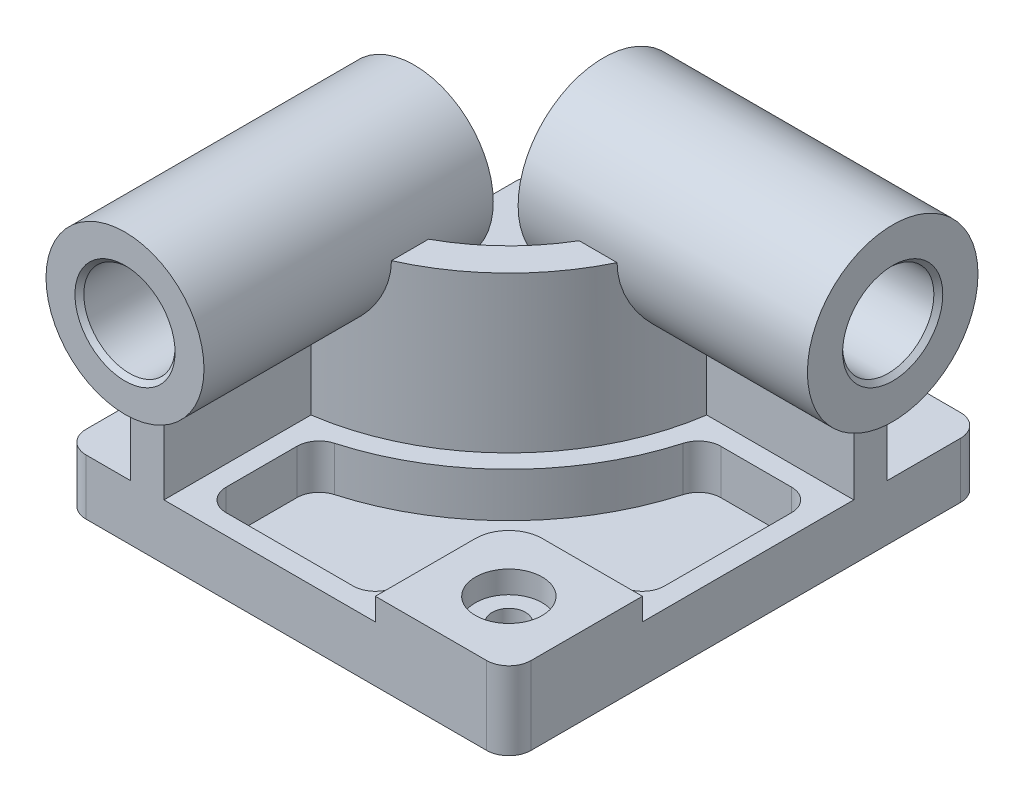
from build123d import *

# Parameters (mm, degrees)
BOSS_EXTRUDE1_DEPTH                     = 25
BOSS_EXTRUDE1_2_DEPTH                   = 25
BOSS_EXTRUDE2_DEPTH                     = 95
BOSS_EXTRUDE3_DEPTH                     = 35
BOSS_EXTRUDE4_DEPTH                     = 5
BOSS_EXTRUDE5_DEPTH                     = 10
BOSS_EXTRUDE5_DEPTH_BACK                = 120
SKETCH2_R                               = 35.5
SKETCH2_R_2                             = 20.5
BOSS_EXTRUDE6_DEPTH                     = 10
BOSS_EXTRUDE6_DEPTH_BACK                = 120
SKETCH3_R                               = 38.333333333
SKETCH3_R_2                             = 20.5
SKETCH4_R                               = 20.5
CUT_EXTRUDE1_DEPTH                      = 275.681684509
SKETCH5_R                               = 20.5
CUT_EXTRUDE2_DEPTH                      = 283.146731022
CHAMFER1_SIZE                           = 2
CBORE_FOR_M8_HEX_HEAD_BOLT1_D           = 15
CBORE_FOR_M8_HEX_HEAD_BOLT1_CBORE_D     = 30
CBORE_FOR_M8_HEX_HEAD_BOLT1_CBORE_DEPTH = 10


with BuildPart() as part:
    # Sketch1 → Boss-Extrude1 (new body)
    with BuildSketch(Plane(origin=(0, 0, 0), x_dir=(1, 0, 0), z_dir=(0, 1, 0))):
        with BuildLine():
            Line((90, 106.5), (-90, 106.5))
            ThreePointArc((-90, 106.5), (-97.071067812, 103.571067812), (-100, 96.5))
            Line((-100, 96.5), (-100, -96.5))
            ThreePointArc((-100, -96.5), (-97.071067812, -103.571067812), (-90, -106.5))
            Line((-90, -106.5), (-70, -106.5))
            Line((-70, -106.5), (-70, -26.5))
            ThreePointArc((-70, -26.5), (-6.360389693, -0.139610307), (20, 63.5))
            Line((20, 63.5), (100, 63.5))
            Line((100, 63.5), (100, 96.5))
            ThreePointArc((100, 96.5), (97.071067812, 103.571067812), (90, 106.5))
        make_face()
    extrude(amount=BOSS_EXTRUDE1_DEPTH)



with BuildPart() as body_2:
    # Sketch1 → Boss-Extrude1 2 (new body)
    with BuildSketch(Plane(origin=(0, 0, 0), x_dir=(1, 0, 0), z_dir=(0, 1, 0))):
        with BuildLine():
            Line((100, -46.5), (100, 48.5))
            Line((100, 48.5), (33.923048454, 48.5))
            ThreePointArc((33.923048454, 48.5), (4.246212025, -10.746212025), (-55, -40.423048454))
            Line((-55, -40.423048454), (-55, -106.5))
            Line((-55, -106.5), (40, -106.5))
            Line((40, -106.5), (40, -61.5))
            ThreePointArc((40, -61.5), (44.393398282, -50.893398282), (55, -46.5))
            Line((55, -46.5), (100, -46.5))
        make_face()
        with BuildLine():
            ThreePointArc((-36, -97.5), (-43.071067812, -94.571067812), (-46, -87.5))
            Line((-46, -87.5), (-46, -55.747641486))
            ThreePointArc((-46, -55.747641486), (-43.981834214, -49.723496519), (-38.741935484, -46.130896205))
            ThreePointArc((-38.741935484, -46.130896205), (10.610173055, -17.110173055), (39.630896205, 32.241935484))
            ThreePointArc((39.630896205, 32.241935484), (43.223496519, 37.481834214), (49.247641486, 39.5))
            Line((49.247641486, 39.5), (81, 39.5))
            ThreePointArc((81, 39.5), (88.071067812, 36.571067812), (91, 29.5))
            Line((91, 29.5), (91, -27.5))
            ThreePointArc((91, -27.5), (88.071067812, -34.571067812), (81, -37.5))
            Line((81, -37.5), (55, -37.5))
            ThreePointArc((55, -37.5), (38.029437252, -44.529437252), (31, -61.5))
            Line((31, -61.5), (31, -87.5))
            ThreePointArc((31, -87.5), (28.071067812, -94.571067812), (21, -97.5))
            Line((21, -97.5), (-36, -97.5))
        make_face(mode=Mode.SUBTRACT)
    extrude(amount=BOSS_EXTRUDE1_2_DEPTH)


with BuildPart() as part_1:
    add(part.part)

    add(body_2.part)  # Boss-Extrude2 merges body 2
    # Sketch1<3> → Boss-Extrude2 (add)
    with BuildSketch(Plane(origin=(0, 0, 0), x_dir=(1, 0, 0), z_dir=(0, 1, 0))):
        with BuildLine():
            Line((100, 48.5), (100, 63.5))
            Line((100, 63.5), (20, 63.5))
            ThreePointArc((20, 63.5), (-6.360389693, -0.139610307), (-70, -26.5))
            Line((-70, -26.5), (-70, -106.5))
            Line((-70, -106.5), (-55, -106.5))
            Line((-55, -106.5), (-55, -40.423048454))
            ThreePointArc((-55, -40.423048454), (4.246212025, -10.746212025), (33.923048454, 48.5))
            Line((33.923048454, 48.5), (100, 48.5))
        make_face()
    extrude(amount=BOSS_EXTRUDE2_DEPTH)

    # Sketch1<4> → Boss-Extrude3 (add)
    with BuildSketch(Plane(origin=(0, 0, 0), x_dir=(1, 0, 0), z_dir=(0, 1, 0))):
        with BuildLine():
            Line((100, -96.5), (100, -46.5))
            Line((100, -46.5), (55, -46.5))
            ThreePointArc((55, -46.5), (44.393398282, -50.893398282), (40, -61.5))
            Line((40, -61.5), (40, -106.5))
            Line((40, -106.5), (90, -106.5))
            ThreePointArc((90, -106.5), (97.071067812, -103.571067812), (100, -96.5))
        make_face()
    extrude(amount=BOSS_EXTRUDE3_DEPTH)

    # Sketch1<5> → Boss-Extrude4 (add)
    with BuildSketch(Plane(origin=(0, 0, 0), x_dir=(1, 0, 0), z_dir=(0, 1, 0))):
        with BuildLine():
            Line((-46, -55.747641486), (-46, -87.5))
            ThreePointArc((-46, -87.5), (-43.071067812, -94.571067812), (-36, -97.5))
            Line((-36, -97.5), (21, -97.5))
            ThreePointArc((21, -97.5), (28.071067812, -94.571067812), (31, -87.5))
            Line((31, -87.5), (31, -61.5))
            ThreePointArc((31, -61.5), (38.029437252, -44.529437252), (55, -37.5))
            Line((55, -37.5), (81, -37.5))
            ThreePointArc((81, -37.5), (88.071067812, -34.571067812), (91, -27.5))
            Line((91, -27.5), (91, 29.5))
            ThreePointArc((91, 29.5), (88.071067812, 36.571067812), (81, 39.5))
            Line((81, 39.5), (49.247641486, 39.5))
            ThreePointArc((49.247641486, 39.5), (43.223496519, 37.481834214), (39.630896205, 32.241935484))
            ThreePointArc((39.630896205, 32.241935484), (10.610173055, -17.110173055), (-38.741935484, -46.130896205))
            ThreePointArc((-38.741935484, -46.130896205), (-43.981834214, -49.723496519), (-46, -55.747641486))
        make_face()
    extrude(amount=BOSS_EXTRUDE4_DEPTH)

    # Sketch2 → Boss-Extrude5 (add, two sides: drawn at the far end of the back side and taken through both)
    with BuildSketch(Plane.XY.offset(106.5).offset(-BOSS_EXTRUDE5_DEPTH_BACK)):
        with Locations((-62.5, 95)):
            Circle(SKETCH2_R)
        with Locations((-62.5, 95)):
            Circle(SKETCH2_R_2, mode=Mode.SUBTRACT)
    extrude(amount=BOSS_EXTRUDE5_DEPTH + BOSS_EXTRUDE5_DEPTH_BACK)

    # Sketch3 → Boss-Extrude6 (add, two sides: drawn at the far end of the back side and taken through both)
    with BuildSketch(Plane(origin=(100, 0, 0), x_dir=(0, 0, -1), z_dir=(1, 0, 0)).offset(-BOSS_EXTRUDE6_DEPTH_BACK)):
        with Locations((56, 95)):
            Circle(SKETCH3_R)
        with Locations((56, 95)):
            Circle(SKETCH3_R_2, mode=Mode.SUBTRACT)
    extrude(amount=BOSS_EXTRUDE6_DEPTH + BOSS_EXTRUDE6_DEPTH_BACK)

    # Sketch4 → Cut-Extrude1 (cut, through all)
    with BuildSketch(Plane(origin=(110, 0, 0), x_dir=(0, 0, -1), z_dir=(1, 0, 0))):
        with Locations((56, 95)):
            Circle(SKETCH4_R)
    extrude(amount=-CUT_EXTRUDE1_DEPTH, mode=Mode.SUBTRACT)

    # Sketch5 → Cut-Extrude2 (cut, through all)
    with BuildSketch(Plane.XY.offset(116.5)):
        with Locations((-62.5, 95)):
            Circle(SKETCH5_R)
    extrude(amount=-CUT_EXTRUDE2_DEPTH, mode=Mode.SUBTRACT)

    # Chamfer1
    chamfer1_edges = [part_1.edges().sort_by_distance(p)[0] for p in [
        (-83, 95, 116.5),
        (-83, 95, -13.5),
        (-20, 95, -35.5),
        (110, 95, -35.5),
    ]]
    chamfer(chamfer1_edges, length=CHAMFER1_SIZE)

    # CBORE for M8 Hex Head Bolt1 (through all)
    with Locations(Plane(origin=(70, 35, 76.5), x_dir=(0, 0, 1), z_dir=(0, 1, 0))):
        with Locations((0, 0)):
            CounterBoreHole(CBORE_FOR_M8_HEX_HEAD_BOLT1_D / 2, CBORE_FOR_M8_HEX_HEAD_BOLT1_CBORE_D / 2, CBORE_FOR_M8_HEX_HEAD_BOLT1_CBORE_DEPTH)


solid = part_1.part
